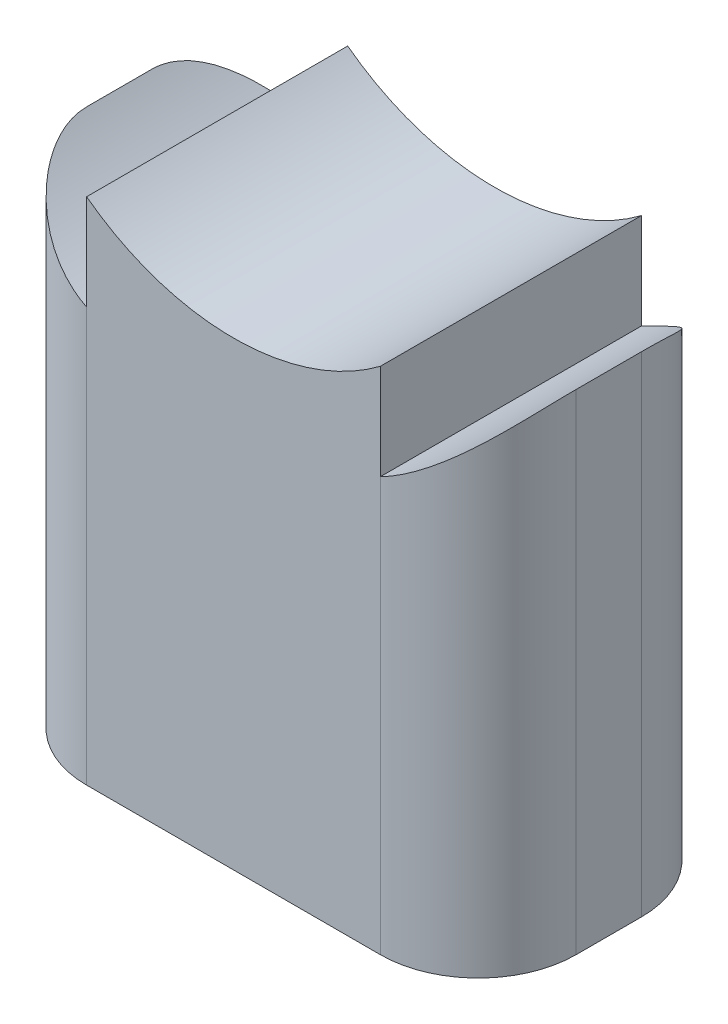
from build123d import *

# Parameters (mm, degrees)
BOSS_EXTRUDE1_DEPTH     = 150
CUT_EXTRUDE1_DEPTH      = 173.409396496
CUT_EXTRUDE1_DEPTH_BACK = 173.409396496
SKETCH3_OUTSIDE_W       = 197.344
SKETCH3_OUTSIDE_H       = 197.344
BOSS_EXTRUDE2_START     = -80
BOSS_EXTRUDE2_DEPTH     = 80


with BuildPart() as part:
    # Sketch1 → Boss-Extrude1 (new body)
    with BuildSketch(Plane(origin=(0, 0, 0), x_dir=(1, 0, 0), z_dir=(0, 1, 0))):
        with BuildLine():
            Line((-45, -40), (45, -40))
            ThreePointArc((45, -40), (66.213203436, -31.213203436), (75, -10))
            Line((75, -10), (75, 10))
            ThreePointArc((75, 10), (66.213203436, 31.213203436), (45, 40))
            Line((45, 40), (-45, 40))
            ThreePointArc((-45, 40), (-66.213203436, 31.213203436), (-75, 10))
            Line((-75, 10), (-75, -10))
            ThreePointArc((-75, -10), (-66.213203436, -31.213203436), (-45, -40))
        make_face()
    extrude(amount=BOSS_EXTRUDE1_DEPTH)

    # Sketch3 outside → Cut-Extrude1 (cut, two sides: drawn at the far end of the back side and taken through both)
    with BuildSketch(Plane.XY.offset(-CUT_EXTRUDE1_DEPTH_BACK)):
        with Locations((0, 75)):
            Rectangle(SKETCH3_OUTSIDE_W, SKETCH3_OUTSIDE_H)
        with BuildLine():
            Line((-75, 150), (-75, 0))
            Line((-75, 0), (75, 0))
            Line((75, 0), (75, 150))
            ThreePointArc((75, 150), (0, 116.143782777), (-75, 150))
        make_face(mode=Mode.SUBTRACT)
    extrude(amount=CUT_EXTRUDE1_DEPTH + CUT_EXTRUDE1_DEPTH_BACK, mode=Mode.SUBTRACT)

    # Sketch6 → Boss-Extrude2 (add)
    with BuildSketch(Plane.XY.offset(40).offset(BOSS_EXTRUDE2_START)):
        with BuildLine():
            Line((-45, 126.840927279), (-45, 156.143782777))
            ThreePointArc((-45, 156.143782777), (0, 141.143782777), (45, 156.143782777))
            Line((45, 156.143782777), (45, 126.840927279))
            ThreePointArc((45, 126.840927279), (0, 116.143782777), (-45, 126.840927279))
        make_face()
    extrude(amount=BOSS_EXTRUDE2_DEPTH)


solid = part.part
